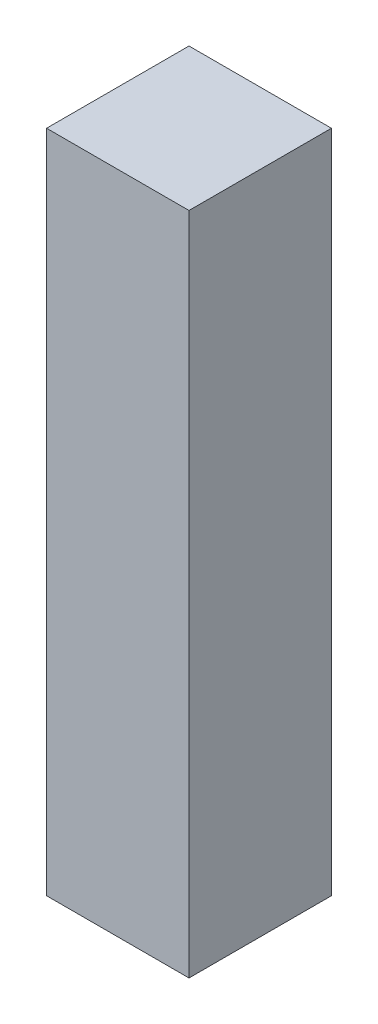
from build123d import *

# Parameters (mm, degrees)
SKETCH1_W           = 6
SKETCH1_H           = 6
BOSS_EXTRUDE1_DEPTH = 28


with BuildPart() as part:
    # Sketch1 → Boss-Extrude1 (new body)
    with BuildSketch(Plane(origin=(0, 0, 0), x_dir=(1, 0, 0), z_dir=(0, 1, 0))):
        Rectangle(SKETCH1_W, SKETCH1_H)
    extrude(amount=BOSS_EXTRUDE1_DEPTH)


solid = part.part
